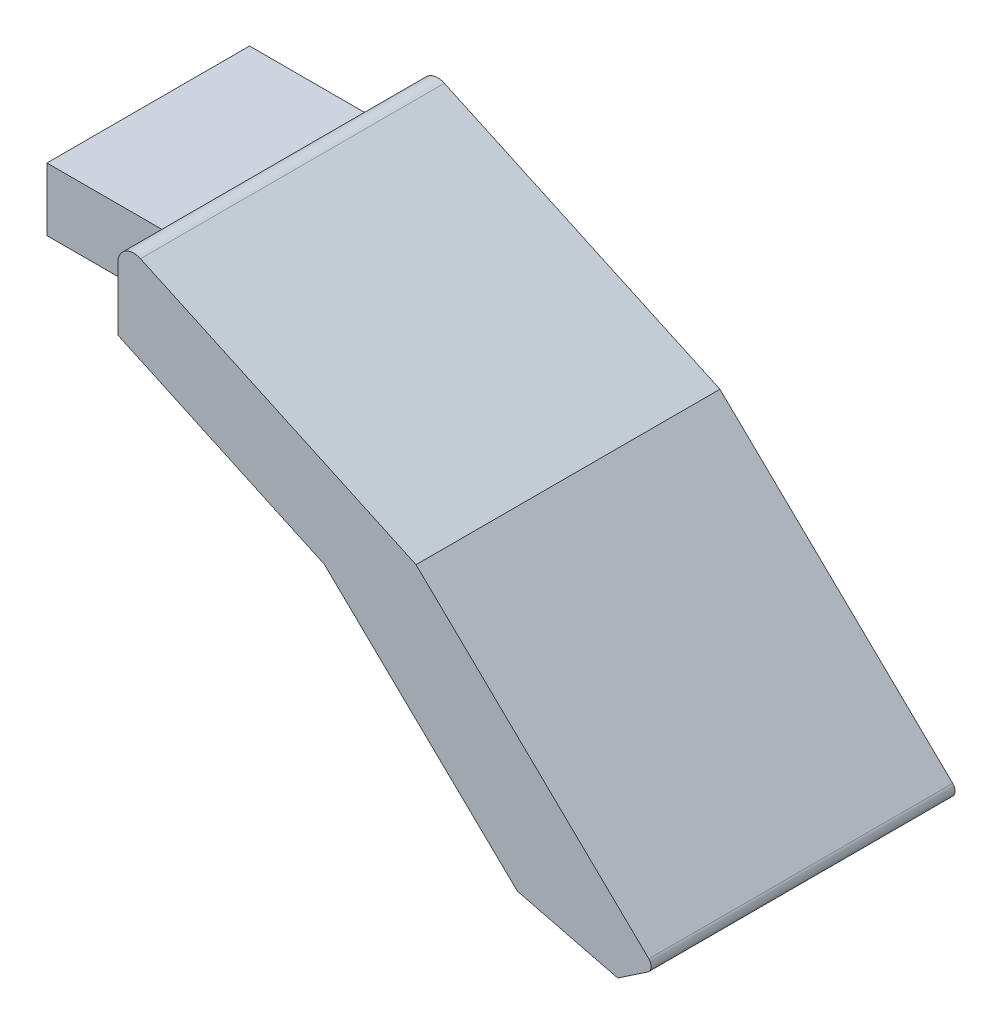
from build123d import *

# Parameters (mm, degrees)
RESSALTO_EXTRUS_O1_DEPTH      = 15
RESSALTO_EXTRUS_O1_DEPTH_BACK = 15
ESBO_O2_W                     = 20
ESBO_O2_H                     = 6.210978077
RESSALTO_EXTRUS_O2_DEPTH      = 12
RESSALTO_EXTRUS_O3_START      = -20
RESSALTO_EXTRUS_O3_DEPTH      = 20
CORTE_EXTRUS_O1_START         = -3.8
ESBO_O6_W                     = 3
ESBO_O6_H                     = 6
CORTE_EXTRUS_O1_DEPTH         = 3.8
ESBO_O7_W                     = 14.512469108
ESBO_O7_H                     = 20
RESSALTO_EXTRUS_O4_DEPTH      = 3


with BuildPart() as part:
    # Esboço1 → Ressalto-extrusão1 (new, two sides: drawn at the far end of the back side and taken through both)
    with BuildSketch(Plane.XY.offset(-RESSALTO_EXTRUS_O1_DEPTH_BACK)):
        with BuildLine():
            Line((0, 16.196411572), (0, 11.255433495))
            Line((0, 11.255433495), (20.3764132, 1.849909993))
            Line((20.3764132, 1.849909993), (39.444832225, -16.570361831))
            Line((39.444832225, -16.570361831), (49.347871005, -19.041211572))
            Line((49.347871005, -19.041211572), (52.316343324, -17.041005068))
            ThreePointArc((52.316343324, -17.041005068), (52.649617834, -16.475732), (52.419959407, -15.861026747))
            Line((52.419959407, -15.861026747), (29.43843308, 6.339343474))
            Line((29.43843308, 6.339343474), (2.234792117, 18.89623864))
            ThreePointArc((2.234792117, 18.89623864), (0.726083483, 18.792939111), (0, 17.466411572))
            Line((0, 17.466411572), (0, 16.196411572))
        make_face()
    extrude(amount=RESSALTO_EXTRUS_O1_DEPTH + RESSALTO_EXTRUS_O1_DEPTH_BACK)

    # Esboço2 → Ressalto-extrusão2 (add)
    with BuildSketch(Plane.ZY):
        with Locations((0, 14.360922534)):
            Rectangle(ESBO_O2_W, ESBO_O2_H)
    extrude(amount=RESSALTO_EXTRUS_O2_DEPTH)

    # Esboço4 → Ressalto-extrusão3 (add)
    with BuildSketch(Plane.XY.offset(10).offset(RESSALTO_EXTRUS_O3_START)):
        Polygon((-4.5, 11.255433495), (-1.5, 11.255433495), (-1.5, 6.255433495), (-0.7, 6.255433495), (-0.7, 6.015731828), (-1.5, 5.255433495), (-4.5, 5.255433495), align=None)
    extrude(amount=RESSALTO_EXTRUS_O3_DEPTH)

    # Esboço6 → Corte-extrusão1 (cut)
    with BuildSketch(Plane.ZY.offset(4.5).offset(CORTE_EXTRUS_O1_START)):
        with Locations((-8.5, 8.255433495)):
            Rectangle(ESBO_O6_W, ESBO_O6_H)
        with Locations((8.5, 8.255433495)):
            Rectangle(ESBO_O6_W, ESBO_O6_H)
    extrude(amount=CORTE_EXTRUS_O1_DEPTH, mode=Mode.SUBTRACT)

    # Esboço7 → Ressalto-extrusão4 (add)
    with BuildSketch(Plane(origin=(10.760423423, 11.139046409, 0), x_dir=(0.7192245636353503, -0.6947776817540559, 0), z_dir=(-0.6947776817540559, -0.7192245636353503, 0))):
        with Locations((26.62617527, 0)):
            Rectangle(ESBO_O7_W, ESBO_O7_H)
    extrude(amount=RESSALTO_EXTRUS_O4_DEPTH)


solid = part.part
